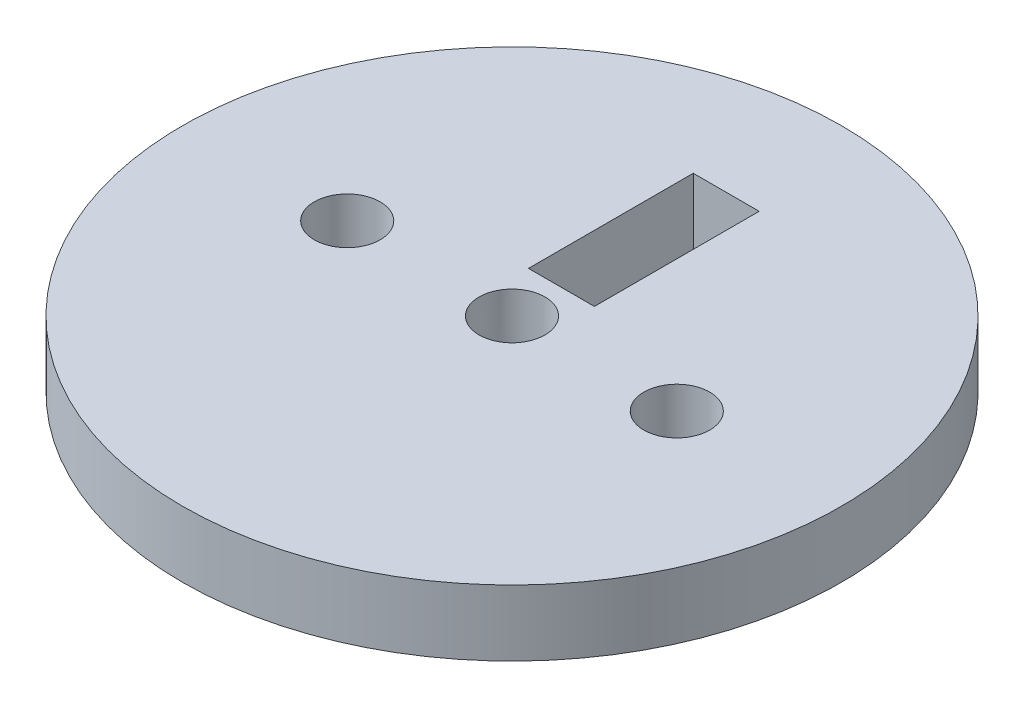
from build123d import *

# Parameters (mm, degrees)
SKETCH1_R           = 10
BOSS_EXTRUDE1_DEPTH = 2
SKETCH2_R           = 1
SKETCH2_W           = 2
SKETCH2_H           = 5
CUT_EXTRUDE1_DEPTH  = 2
SKETCH3_R           = 3.2
CUT_EXTRUDE2_DEPTH  = 0.2


with BuildPart() as part:
    # Sketch1 → Boss-Extrude1 (new body)
    with BuildSketch(Plane(origin=(0, 0, 0), x_dir=(1, 0, 0), z_dir=(0, 1, 0))):
        with Locations(Location((0, 0, 0), (0, 0, 270))):
            Circle(SKETCH1_R)
    extrude(amount=BOSS_EXTRUDE1_DEPTH)

    # Sketch2 → Cut-Extrude1 (cut)
    with BuildSketch(Plane(origin=(0, 2, 0), x_dir=(1, 0, 0), z_dir=(0, 1, 0))):
        with Locations(Location((0, 0, 0), (0, 0, 270))):
            Circle(SKETCH2_R)
        with Locations(Location((5, 0, 0), (0, 0, 270))):
            Circle(SKETCH2_R)
        with Locations(Location((-5, 0, 0), (0, 0, 90))):
            Circle(SKETCH2_R)
        with Locations((0, 4)):
            Rectangle(SKETCH2_W, SKETCH2_H)
    extrude(amount=-CUT_EXTRUDE1_DEPTH, mode=Mode.SUBTRACT)

    # Sketch3 → Cut-Extrude2 (cut)
    with BuildSketch(Plane.XZ):
        Circle(SKETCH3_R)
    extrude(amount=-CUT_EXTRUDE2_DEPTH, mode=Mode.SUBTRACT)


solid = part.part
